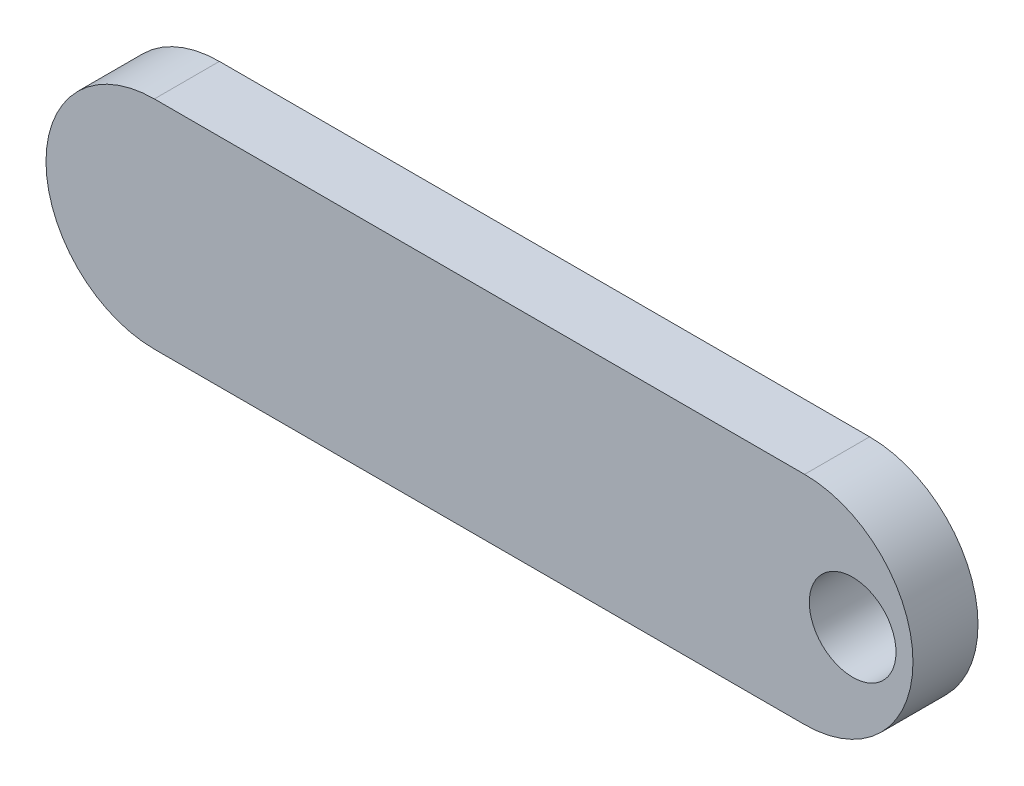
from build123d import *

# Parameters (mm, degrees)
BOSS_EXTRU_1_DEPTH      = 3
ESQUISSE2_R             = 2
ENL_V_MAT_EXTRU_1_DEPTH = 3


with BuildPart() as part:
    # Esquisse1 → Boss.-Extru.1 (new body)
    with BuildSketch(Plane.XY):
        with BuildLine():
            Line((0, 5), (30, 5))
            ThreePointArc((30, 5), (35, 0), (30, -5))
            Line((30, -5), (0, -5))
            ThreePointArc((0, -5), (-5, 0), (0, 5))
        make_face()
    extrude(amount=BOSS_EXTRU_1_DEPTH)

    # Esquisse2 → Enlèv. mat.-Extru.1 (cut)
    with BuildSketch(Plane.XY.offset(3)):
        with Locations((32.217323413, 0)):
            Circle(ESQUISSE2_R)
    extrude(amount=-ENL_V_MAT_EXTRU_1_DEPTH, mode=Mode.SUBTRACT)


solid = part.part
